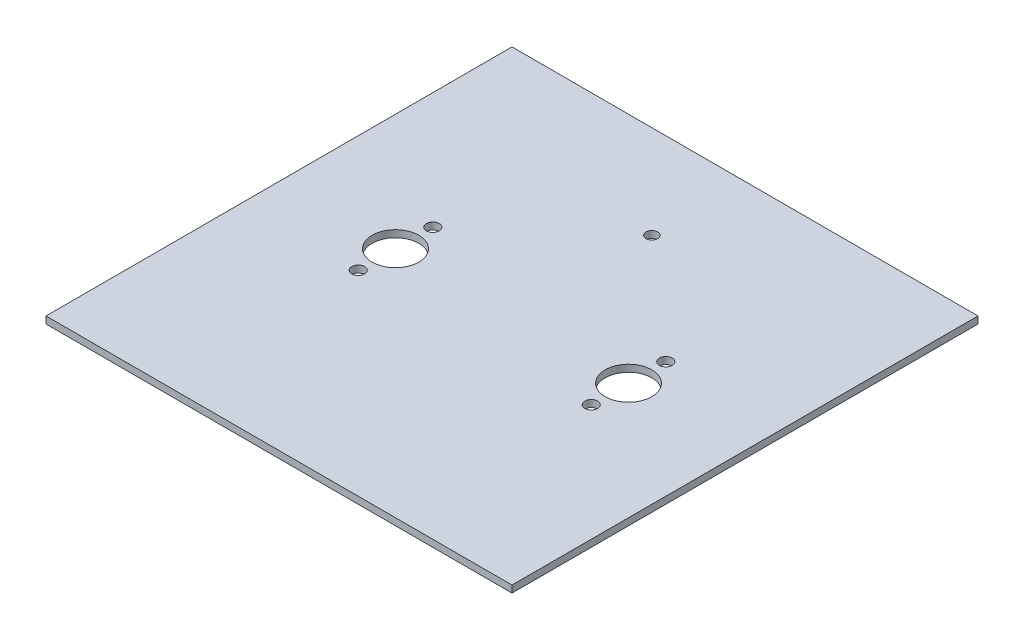
from build123d import *

# Parameters (mm, degrees)
SKETCH_1_W      = 200
SKETCH_1_H      = 200
SKETCH_1_R      = 2.5
SKETCH_1_R_2    = 10
SKETCH_1_R_3    = 2.75
EXTRUDE_1_DEPTH = 3


with BuildPart() as part:
    # 草图1 → 凸台-拉伸1 (new body)
    with BuildSketch(Plane(origin=(0, 0, 0), x_dir=(1, 0, 0), z_dir=(0, 1, 0))):
        Rectangle(SKETCH_1_W, SKETCH_1_H)
        with Locations(Location((0, 60, 0), (0, 0, 270))):
            Circle(SKETCH_1_R, mode=Mode.SUBTRACT)
        with Locations(Location((50, 0, 0), (0, 0, 270))):
            Circle(SKETCH_1_R_2, mode=Mode.SUBTRACT)
        with Locations(Location((50, 16, 0), (0, 0, 270))):
            Circle(SKETCH_1_R_3, mode=Mode.SUBTRACT)
        with Locations(Location((50, -16, 0), (0, 0, 270))):
            Circle(SKETCH_1_R_3, mode=Mode.SUBTRACT)
        with Locations(Location((-50, -16, 0), (0, 0, 90))):
            Circle(SKETCH_1_R_3, mode=Mode.SUBTRACT)
        with Locations(Location((-50, 16, 0), (0, 0, 90))):
            Circle(SKETCH_1_R_3, mode=Mode.SUBTRACT)
        with Locations(Location((-50, 0, 0), (0, 0, 90))):
            Circle(SKETCH_1_R_2, mode=Mode.SUBTRACT)
    extrude(amount=EXTRUDE_1_DEPTH)


solid = part.part
